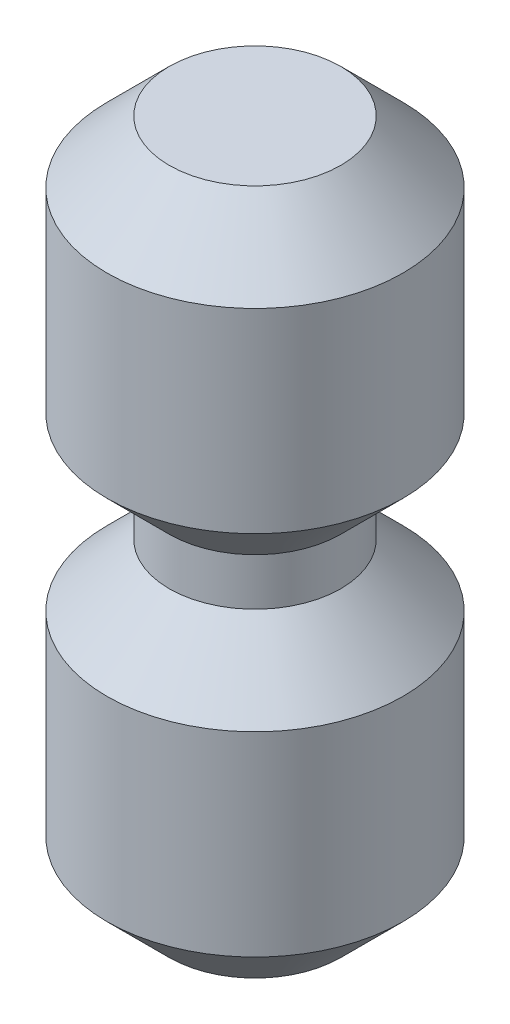
from build123d import *


with BuildPart() as part:
    # Sketch1 → Revolve1 (revolve)
    with BuildSketch(Plane.XY, mode=Mode.PRIVATE) as revolve1_sk:
        Polygon((1, 4), (1.725, 3.275), (1.725, 1), (1, 0.275), (1, -0.275), (1.725, -1), (1.725, -3.275), (1, -4), (0, -4), (0, 4), align=None)
    revolve(revolve1_sk.sketch.rotate(Axis((0, 0, 0), (0, 1, 0)), 90), axis=Axis((0, 0, 0), (0, 1, 0)))


solid = part.part
